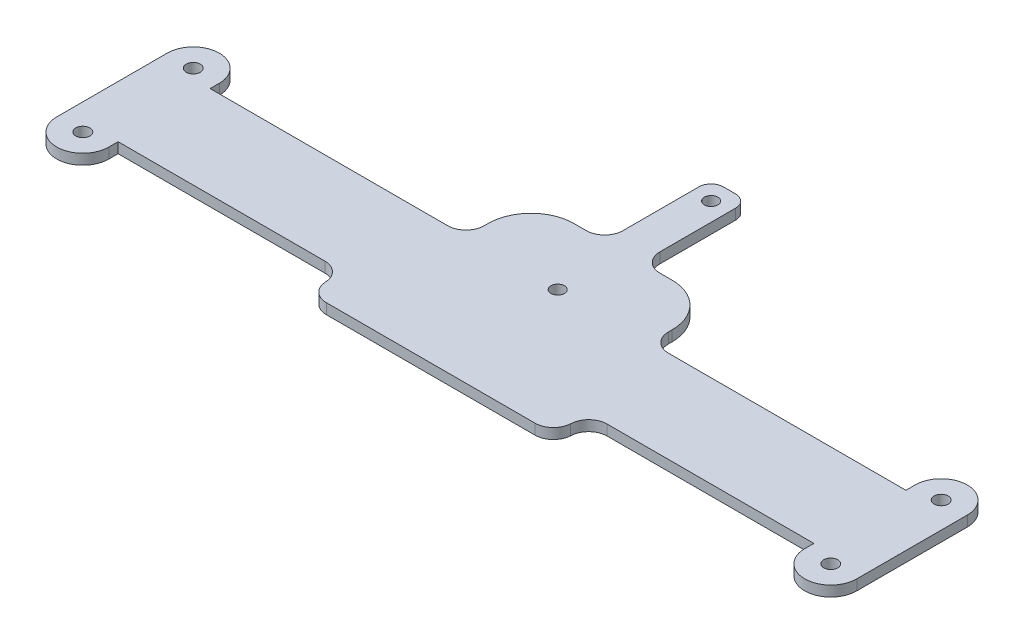
from build123d import *

# Parameters (mm, degrees)
SZKIC1_R                    = 1.15
SZKIC1_R_2                  = 1.150012437
SZKIC1_R_3                  = 1.1
DODANIE_WYCI_GNI_CIE1_DEPTH = 1.7


with BuildPart() as part:
    # Szkic1 → Dodanie-wyciągnięcie1 (new body)
    with BuildSketch(Plane.XZ.offset(-7.087491716)):
        with BuildLine():
            Line((-166.869010382, 45.27), (-166.869010382, 48.27))
            ThreePointArc((-166.869010382, 48.27), (-162.619010382, 52.52), (-158.369010382, 48.27))
            Line((-158.369010382, 48.27), (-158.369010382, 46.77))
            Line((-158.369010382, 46.77), (-124.668997945, 46.77))
            ThreePointArc((-124.668997945, 46.77), (-122.547677602, 47.648679656), (-121.668997945, 49.77))
            Line((-121.668997945, 49.77), (-121.668997945, 49.52))
            ThreePointArc((-121.668997945, 49.52), (-120.790318289, 51.641320344), (-118.668997945, 52.52))
            Line((-118.668997945, 52.52), (-84.668997945, 52.52))
            ThreePointArc((-84.668997945, 52.52), (-82.547677602, 51.641320344), (-81.668997945, 49.52))
            Line((-81.668997945, 49.52), (-81.668997945, 49.77))
            ThreePointArc((-81.668997945, 49.77), (-80.790318289, 47.648679656), (-78.668997945, 46.77))
            Line((-78.668997945, 46.77), (-44.968985509, 46.77))
            Line((-44.968985509, 46.77), (-44.968985509, 48.27))
            ThreePointArc((-44.968985509, 48.27), (-40.718985509, 52.52), (-36.468985509, 48.27))
            Line((-36.468985509, 48.27), (-36.468985509, 45.27))
            Line((-36.468985509, 45.27), (-36.468985509, 33.27))
            Line((-36.468985509, 33.27), (-36.468985509, 30.27))
            ThreePointArc((-36.468985509, 30.27), (-40.718985509, 26.02), (-44.968985509, 30.27))
            Line((-44.968985509, 30.27), (-44.968985509, 31.77))
            Line((-44.968985509, 31.77), (-83.668997945, 31.77))
            ThreePointArc((-83.668997945, 31.77), (-85.790318289, 30.891320344), (-86.668997945, 28.77))
            Line((-86.668997945, 28.77), (-86.668997945, 28.17))
            ThreePointArc((-86.668997945, 28.17), (-88.719250477, 23.220252532), (-93.668997945, 21.17))
            Line((-93.668997945, 21.17), (-95.668997945, 21.17))
            ThreePointArc((-95.668997945, 21.17), (-97.790318289, 20.291320344), (-98.668997945, 18.17))
            Line((-98.668997945, 18.17), (-98.668997945, 5.82))
            ThreePointArc((-98.668997945, 5.82), (-99.254784383, 4.405786438), (-100.668997945, 3.82))
            Line((-100.668997945, 3.82), (-102.668997945, 3.82))
            ThreePointArc((-102.668997945, 3.82), (-104.083211508, 4.405786438), (-104.668997945, 5.82))
            Line((-104.668997945, 5.82), (-104.668997945, 18.17))
            ThreePointArc((-104.668997945, 18.17), (-105.547677602, 20.291320344), (-107.668997945, 21.17))
            Line((-107.668997945, 21.17), (-109.668997945, 21.17))
            ThreePointArc((-109.668997945, 21.17), (-114.618745414, 23.220252532), (-116.668997945, 28.17))
            Line((-116.668997945, 28.17), (-116.668997945, 28.77))
            ThreePointArc((-116.668997945, 28.77), (-117.547677602, 30.891320344), (-119.668997945, 31.77))
            Line((-119.668997945, 31.77), (-158.369010382, 31.77))
            Line((-158.369010382, 31.77), (-158.369010382, 30.27))
            ThreePointArc((-158.369010382, 30.27), (-162.619010382, 26.02), (-166.869010382, 30.27))
            Line((-166.869010382, 30.27), (-166.869010382, 33.27))
            Line((-166.869010382, 33.27), (-166.869010382, 45.27))
        make_face()
        with Locations((-162.618997945, 30.27)):
            Circle(SZKIC1_R, mode=Mode.SUBTRACT)
        with Locations((-162.618997945, 48.27)):
            Circle(SZKIC1_R, mode=Mode.SUBTRACT)
        with Locations((-40.718985509, 48.27)):
            Circle(SZKIC1_R_2, mode=Mode.SUBTRACT)
        with Locations((-40.718985509, 30.27)):
            Circle(SZKIC1_R_2, mode=Mode.SUBTRACT)
        with Locations((-101.668997945, 31.82)):
            Circle(SZKIC1_R_3, mode=Mode.SUBTRACT)
        with Locations((-101.668997945, 6.82)):
            Circle(SZKIC1_R_3, mode=Mode.SUBTRACT)
    extrude(amount=DODANIE_WYCI_GNI_CIE1_DEPTH)


solid = part.part
